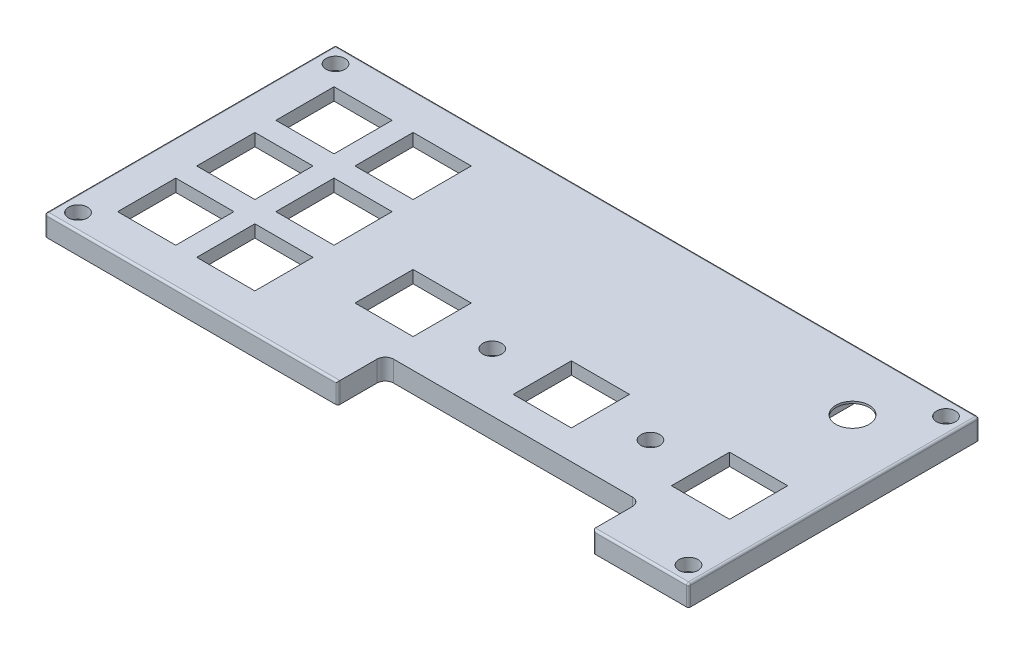
from build123d import *

# Parameters (mm, degrees)
SKETCH1_R           = 2.275
SKETCH1_R_2         = 4
SKETCH1_W           = 14
SKETCH1_H           = 14
BOSS_EXTRUDE1_DEPTH = 3
SKETCH2_R           = 1.5
SKETCH2_R_2         = 4
SKETCH2_W           = 37.05
SKETCH2_H           = 56.1
SKETCH2_W_2         = 18
SKETCH2_H_2         = 18
BOSS_EXTRUDE2_DEPTH = 2
SKETCH3_W           = 14.2
SKETCH3_H           = 17.5
CUT_EXTRUDE1_DEPTH  = 4.5
SKETCH4_W           = 61.5
SKETCH4_H           = 11.425
CUT_EXTRUDE2_DEPTH  = 171.146995272
FILLET1_R           = 0.5
FILLET2_R           = 2


with BuildPart() as part:
    # Sketch1 → Boss-Extrude1 (new body)
    with BuildSketch(Plane(origin=(0, 0, 0), x_dir=(1, 0, 0), z_dir=(0, 1, 0))):
        with BuildLine():
            Line((0.5, 0), (154.5, 0))
            ThreePointArc((154.5, 0), (154.853553391, 0.146446609), (155, 0.5))
            Line((155, 0.5), (155, 69.5))
            ThreePointArc((155, 69.5), (154.853553391, 69.853553391), (154.5, 70))
            Line((154.5, 70), (0.5, 70))
            ThreePointArc((0.5, 70), (0.146446609, 69.853553391), (0, 69.5))
            Line((0, 69.5), (0, 0.5))
            ThreePointArc((0, 0.5), (0.146446609, 0.146446609), (0.5, 0))
        make_face()
        with Locations(Location((4, 66, 0), (0, 0, 270))):
            Circle(SKETCH1_R, mode=Mode.SUBTRACT)
        with Locations(Location((4, 4, 0), (0, 0, 90))):
            Circle(SKETCH1_R, mode=Mode.SUBTRACT)
        with Locations(Location((151, 4, 0), (0, 0, 270))):
            Circle(SKETCH1_R, mode=Mode.SUBTRACT)
        with Locations(Location((151, 66, 0), (0, 0, 90))):
            Circle(SKETCH1_R, mode=Mode.SUBTRACT)
        with Locations(Location((82.2625, 25.475, 0), (0, 0, 270))):
            Circle(SKETCH1_R, mode=Mode.SUBTRACT)
        with Locations(Location((120.3625, 25.475, 0), (0, 0, 270))):
            Circle(SKETCH1_R, mode=Mode.SUBTRACT)
        with Locations(Location((139.4125, 55.075, 0), (0, 0, 270))):
            Circle(SKETCH1_R_2, mode=Mode.SUBTRACT)
        with Locations((15.5875, 54.05)):
            Rectangle(SKETCH1_W, SKETCH1_H, mode=Mode.SUBTRACT)
        with Locations((34.6375, 54.05)):
            Rectangle(SKETCH1_W, SKETCH1_H, mode=Mode.SUBTRACT)
        with Locations((34.6375, 35)):
            Rectangle(SKETCH1_W, SKETCH1_H, mode=Mode.SUBTRACT)
        with Locations((34.6375, 15.95)):
            Rectangle(SKETCH1_W, SKETCH1_H, mode=Mode.SUBTRACT)
        with Locations((15.5875, 35)):
            Rectangle(SKETCH1_W, SKETCH1_H, mode=Mode.SUBTRACT)
        with Locations((15.5875, 15.95)):
            Rectangle(SKETCH1_W, SKETCH1_H, mode=Mode.SUBTRACT)
        with Locations((101.3125, 25.475)):
            Rectangle(SKETCH1_W, SKETCH1_H, mode=Mode.SUBTRACT)
        with Locations((63.2125, 25.475)):
            Rectangle(SKETCH1_W, SKETCH1_H, mode=Mode.SUBTRACT)
        with Locations((139.4125, 25.475)):
            Rectangle(SKETCH1_W, SKETCH1_H, mode=Mode.SUBTRACT)
    extrude(amount=-BOSS_EXTRUDE1_DEPTH)

    # Sketch2 → Boss-Extrude2 (add)
    with BuildSketch(Plane(origin=(0, -3, 0), x_dir=(-1, 0, 0), z_dir=(0, -1, 0))):
        with BuildLine():
            Line((-0.5, 70), (-154.5, 70))
            ThreePointArc((-154.5, 70), (-154.853553391, 69.853553391), (-155, 69.5))
            Line((-155, 69.5), (-155, 0.5))
            ThreePointArc((-155, 0.5), (-154.853553391, 0.146446609), (-154.5, 0))
            Line((-154.5, 0), (-0.5, 0))
            ThreePointArc((-0.5, 0), (-0.146446609, 0.146446609), (0, 0.5))
            Line((0, 0.5), (0, 69.5))
            ThreePointArc((0, 69.5), (-0.146446609, 69.853553391), (-0.5, 70))
        make_face()
        with Locations(Location((-4, 66, 0), (0, 0, 270))):
            Circle(SKETCH2_R, mode=Mode.SUBTRACT)
        with Locations(Location((-4, 4, 0), (0, 0, 270))):
            Circle(SKETCH2_R, mode=Mode.SUBTRACT)
        with Locations(Location((-151, 4, 0), (0, 0, 270))):
            Circle(SKETCH2_R, mode=Mode.SUBTRACT)
        with Locations(Location((-151, 66, 0), (0, 0, 270))):
            Circle(SKETCH2_R, mode=Mode.SUBTRACT)
        with Locations(Location((-82.2625, 25.475, 0), (0, 0, 270))):
            Circle(SKETCH2_R, mode=Mode.SUBTRACT)
        with Locations(Location((-120.3625, 25.475, 0), (0, 0, 270))):
            Circle(SKETCH2_R, mode=Mode.SUBTRACT)
        with Locations(Location((-139.4125, 55.075, 0), (0, 0, 270))):
            Circle(SKETCH2_R_2, mode=Mode.SUBTRACT)
        with Locations((-25.1125, 35)):
            Rectangle(SKETCH2_W, SKETCH2_H, mode=Mode.SUBTRACT)
        with Locations((-63.2125, 25.475)):
            Rectangle(SKETCH2_W_2, SKETCH2_H_2, mode=Mode.SUBTRACT)
        with Locations((-101.3125, 25.475)):
            Rectangle(SKETCH2_W_2, SKETCH2_H_2, mode=Mode.SUBTRACT)
        with Locations((-139.4125, 25.475)):
            Rectangle(SKETCH2_W_2, SKETCH2_H_2, mode=Mode.SUBTRACT)
    extrude(amount=BOSS_EXTRUDE2_DEPTH)

    # Sketch3 → Cut-Extrude1 (cut)
    with BuildSketch(Plane(origin=(0, -5, 0), x_dir=(-1, 0, 0), z_dir=(0, -1, 0))):
        with Locations((-139.4125, 55.075)):
            Rectangle(SKETCH3_W, SKETCH3_H)
    extrude(amount=-CUT_EXTRUDE1_DEPTH, mode=Mode.SUBTRACT)

    # Sketch4 → Cut-Extrude2 (cut, through all)
    with BuildSketch(Plane(origin=(0, 0, 0), x_dir=(1, 0, 0), z_dir=(0, 1, 0))):
        with Locations((101.3125, 5.7125)):
            Rectangle(SKETCH4_W, SKETCH4_H)
    extrude(amount=-CUT_EXTRUDE2_DEPTH, mode=Mode.SUBTRACT)

    # Fillet1
    fillet1_edges = [part.edges().sort_by_distance(p)[0] for p in [
        (0, 0, -35),
        (0.146446609, 0, -69.853553391),
        (77.5, 0, -70),
        (154.853553391, 0, -69.853553391),
        (143.28125, 0, 0),
        (132.0625, -2.5, 0),
        (70.5625, -2.5, 0),
        (155, 0, -35),
        (154.853553391, 0, -0.146446609),
        (35.53125, 0, 0),
        (0.146446609, 0, -0.146446609),
    ]]
    fillet(fillet1_edges, radius=FILLET1_R)

    # Fillet2
    fillet2_edges = [part.edges().sort_by_distance(p)[0] for p in [
        (70.5625, -2.5, -11.425),
        (132.0625, -2.5, -11.425),
    ]]
    fillet(fillet2_edges, radius=FILLET2_R)


solid = part.part
